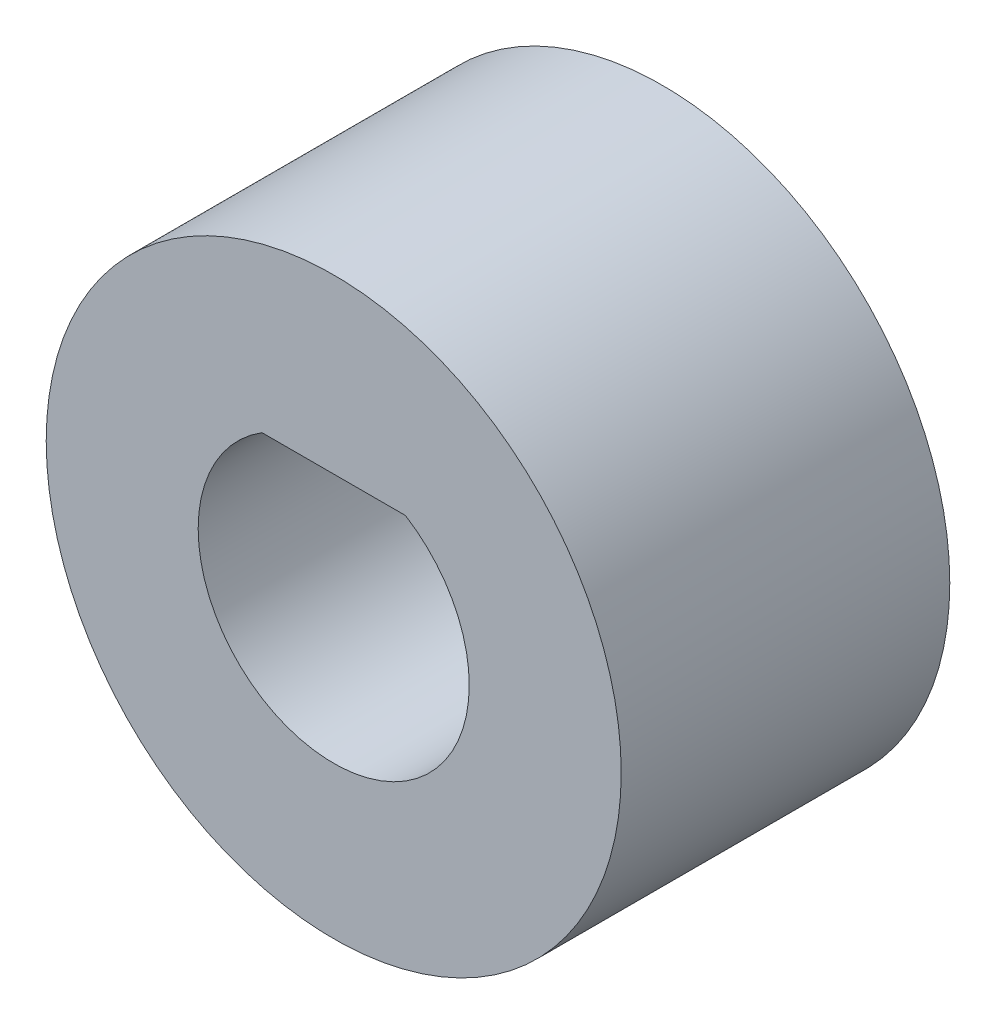
from build123d import *

# Parameters (mm, degrees)
ESQUISSE1_R        = 7
BOSS_EXTRU_1_DEPTH = 8


with BuildPart() as part:
    # Esquisse1 → Boss.-Extru.1 (new body)
    with BuildSketch(Plane.XY):
        Circle(ESQUISSE1_R)
        with BuildLine():
            Line((-1.74642492, 2.8), (1.74642492, 2.8))
            ThreePointArc((1.74642492, 2.8), (0, -3.3), (-1.74642492, 2.8))
        make_face(mode=Mode.SUBTRACT)
    extrude(amount=BOSS_EXTRU_1_DEPTH)


solid = part.part
